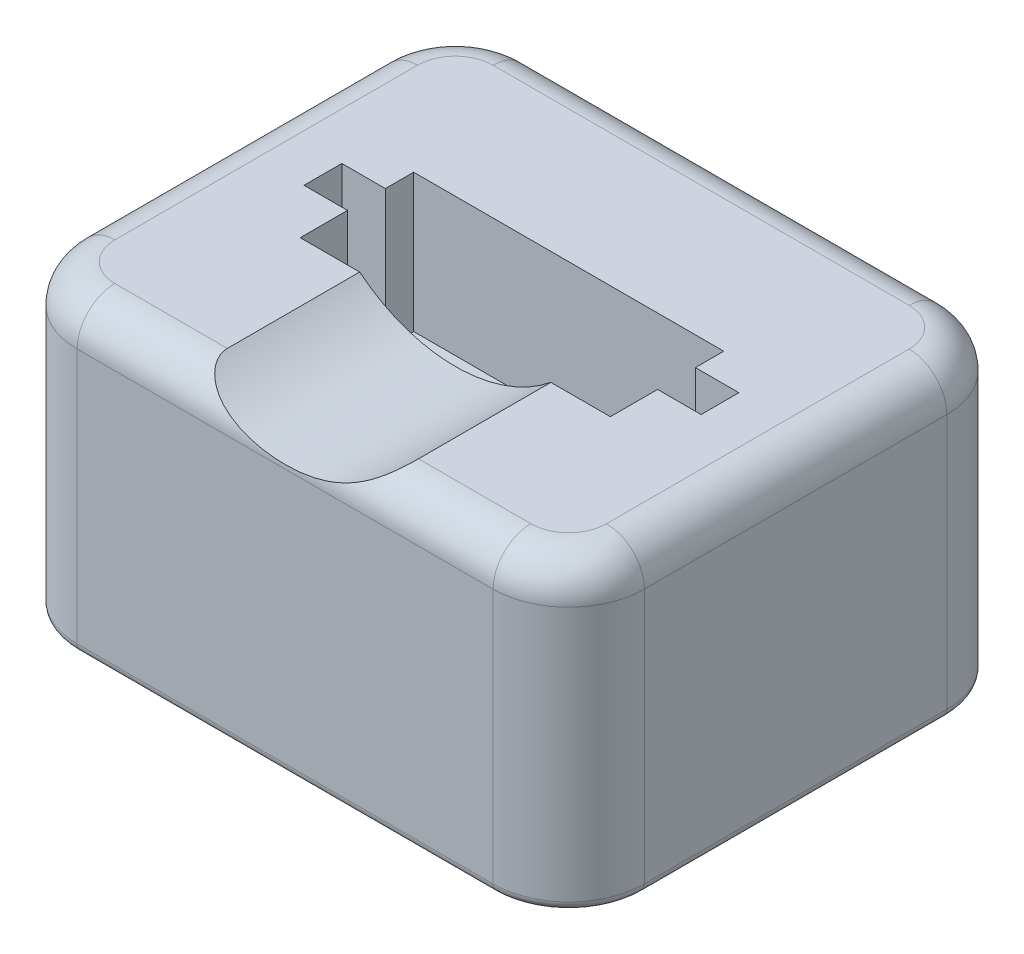
from build123d import *

# Parameters (mm, degrees)
EXTRUDE_1_DEPTH     = 16
SKETCH_6_R          = 1
CUT_EXTRUDE_5_DEPTH = 7
FILLET_2_R          = 0.5
FILLET_1_R          = 2
CUT_EXTRUDE_1_REACH = 43.617
SKETCH_3_W          = 16.4
SKETCH_3_H          = 3
CUT_EXTRUDE_6_DEPTH = 7.3
CUT_EXTRUDE_7_REACH = 43.617
SKETCH_8_R          = 8


with BuildPart() as part:
    # Эскиз1 → Бобышка-Вытянуть1 (new body)
    with BuildSketch(Plane(origin=(0, 0, 0), x_dir=(1, 0, 0), z_dir=(0, 1, 0))):
        with BuildLine():
            Line((4, 0), (26, 0))
            ThreePointArc((26, 0), (28.828427125, 1.171572875), (30, 4))
            Line((30, 4), (30, 20))
            ThreePointArc((30, 20), (28.828427125, 22.828427125), (26, 24))
            Line((26, 24), (4, 24))
            ThreePointArc((4, 24), (1.171572875, 22.828427125), (0, 20))
            Line((0, 20), (0, 4))
            ThreePointArc((0, 4), (1.171572875, 1.171572875), (4, 0))
        make_face()
    extrude(amount=EXTRUDE_1_DEPTH)

    # Эскиз6 → Вырез-Вытянуть5 (cut)
    with BuildSketch(Plane.XZ):
        with Locations(Location((4, -4, 0), (0, 0, 270))):
            Circle(SKETCH_6_R)
        with Locations(Location((26, -4, 0), (0, 0, 270))):
            Circle(SKETCH_6_R)
        with Locations(Location((26, -20, 0), (0, 0, 270))):
            Circle(SKETCH_6_R)
        with Locations(Location((4, -20, 0), (0, 0, 270))):
            Circle(SKETCH_6_R)
    extrude(amount=-CUT_EXTRUDE_5_DEPTH, mode=Mode.SUBTRACT)

    # Скругление2
    fillet_2_edges = [part.edges().sort_by_distance(p)[0] for p in [
        (0, 0, -12),
        (1.171572875, 0, -22.828427125),
        (15, 0, -24),
        (28.828427125, 0, -22.828427125),
        (4, 0, -19),
        (26, 0, -19),
        (26, 0, -3),
        (4, 0, -3),
        (30, 0, -12),
        (28.828427125, 0, -1.171572875),
        (15, 0, 0),
        (1.171572875, 0, -1.171572875),
    ]]
    fillet(fillet_2_edges, radius=FILLET_2_R)

    # Скругление1
    fillet_1_edges = [part.edges().sort_by_distance(p)[0] for p in [
        (1.171572875, 16, -22.828427125),
        (0, 16, -12),
        (1.171572875, 16, -1.171572875),
        (15, 16, 0),
        (28.828427125, 16, -1.171572875),
        (30, 16, -12),
        (28.828427125, 16, -22.828427125),
        (15, 16, -24),
    ]]
    fillet(fillet_1_edges, radius=FILLET_1_R)

    # Эскиз3 → Вырез-Вытянуть1 (cut, up to next)
    with BuildSketch(Plane(origin=(0, 16, 0), x_dir=(1, 0, 0), z_dir=(0, 1, 0)), mode=Mode.PRIVATE) as cut_extrude_1_sk1:
        with Locations((15, 10.5)):
            Rectangle(SKETCH_3_W, SKETCH_3_H)
    cut_extrude_1_tool1 = extrude(cut_extrude_1_sk1.sketch, amount=-CUT_EXTRUDE_1_REACH, mode=Mode.PRIVATE) & part.part
    add(cut_extrude_1_tool1.solids().sort_by_distance((15, 16, -10.5))[0], mode=Mode.SUBTRACT)

    # Эскиз7 → Вырез-Вытянуть6 (cut)
    with BuildSketch(Plane(origin=(0, 16, 0), x_dir=(1, 0, 0), z_dir=(0, 1, 0))):
        Polygon((4.5, 11.5), (25.5, 11.5), (25.5, 13.5), (23.2, 13.5), (23.2, 15), (6.8, 15), (6.8, 13.5), (4.5, 13.5), align=None)
    extrude(amount=-CUT_EXTRUDE_6_DEPTH, mode=Mode.SUBTRACT)

    # Эскиз8 → Вырез-Вытянуть7 (cut, up to next)
    with BuildSketch(Plane.XY, mode=Mode.PRIVATE) as cut_extrude_7_sk1:
        with Locations((15, 22.2)):
            Circle(SKETCH_8_R)
    cut_extrude_7_tool1 = extrude(cut_extrude_7_sk1.sketch, amount=-CUT_EXTRUDE_7_REACH, mode=Mode.PRIVATE) & part.part
    add(cut_extrude_7_tool1.solids().sort_by_distance((15, 22.2, 0))[0], mode=Mode.SUBTRACT)


solid = part.part
